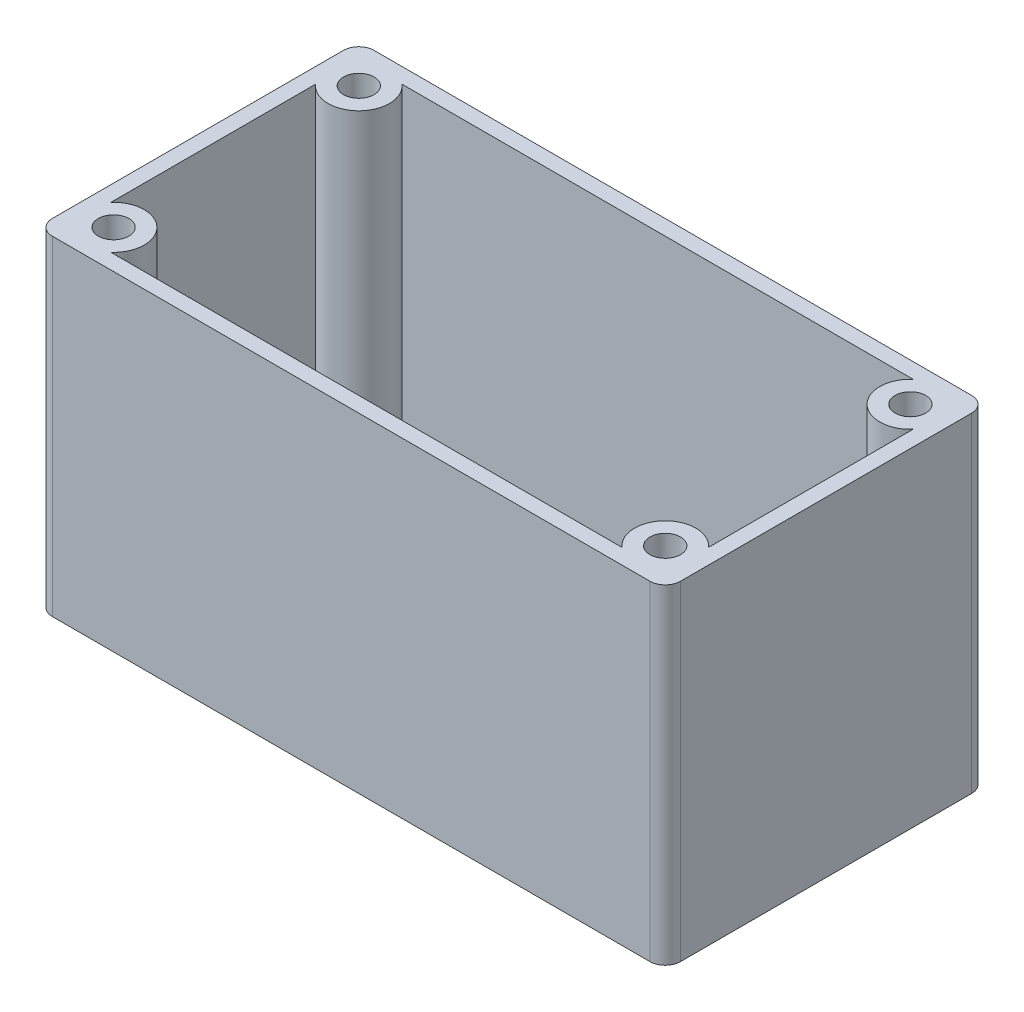
from build123d import *

# Parameters (mm, degrees)
ESQUISSE1_R        = 1
BOSS_EXTRU_1_DEPTH = 21.5


with BuildPart() as part:
    # Esquisse1 → Boss.-Extru.1 (new body)
    with BuildSketch(Plane(origin=(0, 0, 0), x_dir=(1, 0, 0), z_dir=(0, 1, 0))):
        with BuildLine():
            Line((1, 0), (40, 0))
            ThreePointArc((40, 0), (40.707106781, 0.292893219), (41, 1))
            Line((41, 1), (41, 20))
            ThreePointArc((41, 20), (40.707106781, 20.707106781), (40, 21))
            Line((40, 21), (1, 21))
            ThreePointArc((1, 21), (0.292893219, 20.707106781), (0, 20))
            Line((0, 20), (0, 1))
            ThreePointArc((0, 1), (0.292893219, 0.292893219), (1, 0))
        make_face()
        with Locations(Location((2.5, 18.5, 0), (0, 0, 270))):
            Circle(ESQUISSE1_R, mode=Mode.SUBTRACT)
        with Locations(Location((38.5, 18.5, 0), (0, 0, 270))):
            Circle(ESQUISSE1_R, mode=Mode.SUBTRACT)
        with Locations(Location((38.5, 2.5, 0), (0, 0, 270))):
            Circle(ESQUISSE1_R, mode=Mode.SUBTRACT)
        with Locations(Location((2.5, 2.5, 0), (0, 0, 270))):
            Circle(ESQUISSE1_R, mode=Mode.SUBTRACT)
        with BuildLine():
            Line((3.822875656, 20), (37.177124344, 20))
            ThreePointArc((37.177124344, 20), (37.085786438, 17.085786438), (40, 17.177124344))
            Line((40, 17.177124344), (40, 3.822875656))
            ThreePointArc((40, 3.822875656), (37.085786438, 3.914213562), (37.177124344, 1))
            Line((37.177124344, 1), (3.822875656, 1))
            ThreePointArc((3.822875656, 1), (3.914213562, 3.914213562), (1, 3.822875656))
            Line((1, 3.822875656), (1, 17.177124344))
            ThreePointArc((1, 17.177124344), (3.914213562, 17.085786438), (3.822875656, 20))
        make_face(mode=Mode.SUBTRACT)
    extrude(amount=BOSS_EXTRU_1_DEPTH)


solid = part.part
